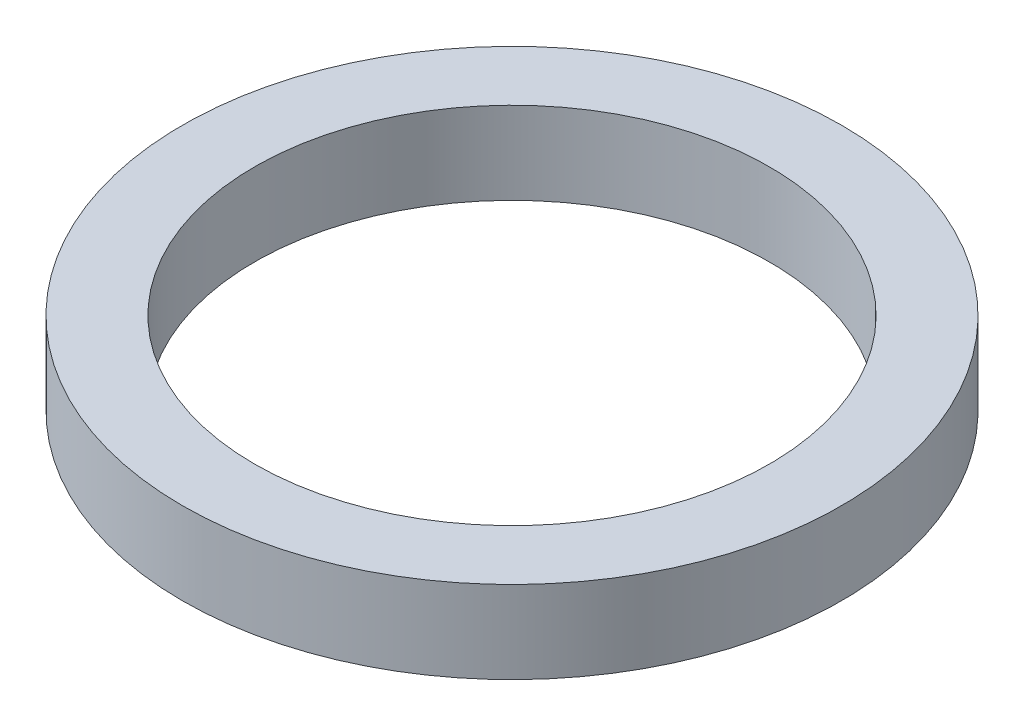
from build123d import *

# Parameters (mm, degrees)
SKETCH1_R           = 16
SKETCH1_R_2         = 12.5
BOSS_EXTRUDE1_DEPTH = 4


with BuildPart() as part:
    # Sketch1 → Boss-Extrude1 (new body)
    with BuildSketch(Plane(origin=(0, 14, 0), x_dir=(1, 0, 0), z_dir=(0, 1, 0))):
        with Locations(Location((-0.5, 0, 0), (0, 0, 270))):
            Circle(SKETCH1_R)
        with Locations(Location((-0.5, 0, 0), (0, 0, 270))):
            Circle(SKETCH1_R_2, mode=Mode.SUBTRACT)
    extrude(amount=-BOSS_EXTRUDE1_DEPTH)


solid = part.part
